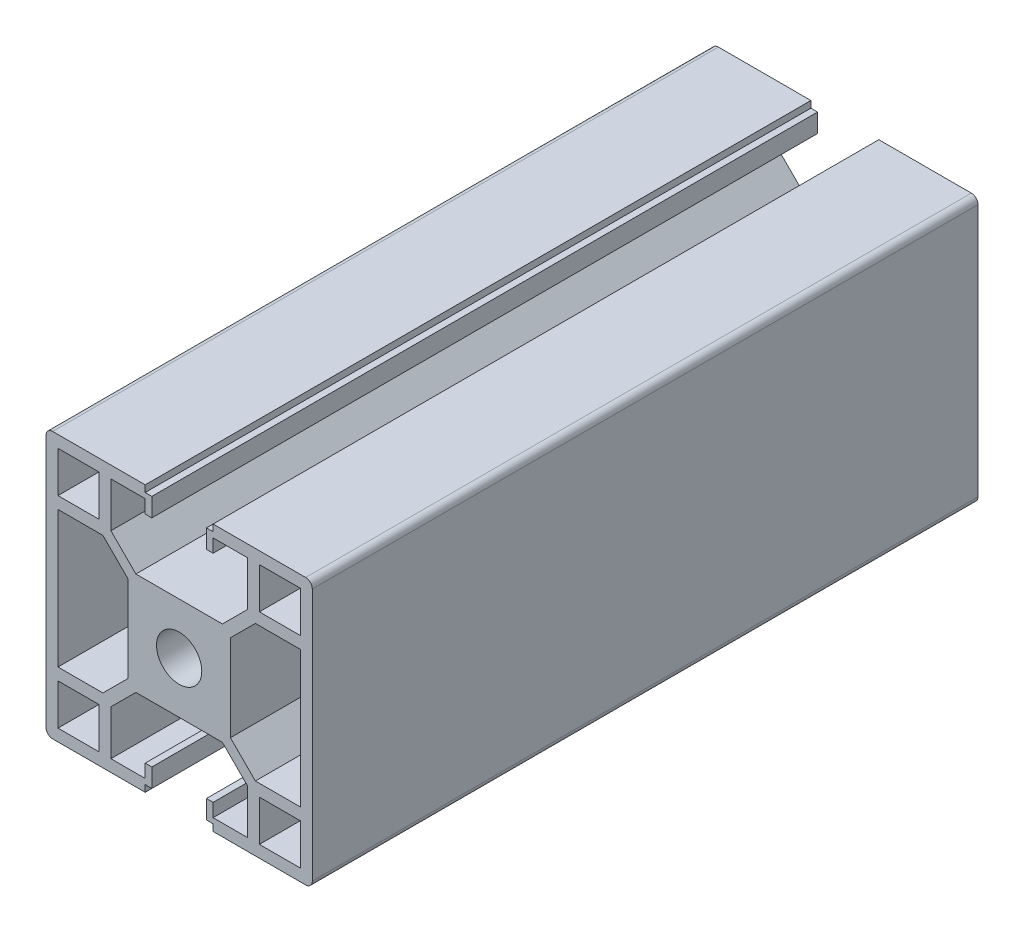
from build123d import *

# Parameters (mm, degrees)
SKETCH_1_R      = 3.4
SKETCH_1_W      = 6.15
SKETCH_1_H      = 6.15
EXTRUDE_1_DEPTH = 100


with BuildPart() as part:
    # 草图1 → 凸台-拉伸1 (new body)
    with BuildSketch(Plane.XY):
        with BuildLine():
            Line((-4.068782805, 19.545792426), (-17.968782805, 19.545792426))
            ThreePointArc((-17.968782805, 19.545792426), (-18.675889586, 19.252899208), (-18.968782805, 18.545792426))
            Line((-18.968782805, 18.545792426), (-18.968782805, -19.454207574))
            ThreePointArc((-18.968782805, -19.454207574), (-18.675889586, -20.161314355), (-17.968782805, -20.454207574))
            Line((-17.968782805, -20.454207574), (-4.068782805, -20.454207574))
            Line((-4.068782805, -20.454207574), (-4.068782805, -19.454207574))
            Line((-4.068782805, -19.454207574), (-3.068782805, -19.454207574))
            Line((-3.068782805, -19.454207574), (-3.068782805, -16.654207574))
            Line((-3.068782805, -16.654207574), (-4.068782805, -16.654207574))
            Line((-4.068782805, -16.654207574), (-4.068782805, -18.654207574))
            Line((-4.068782805, -18.654207574), (-9.218782805, -18.654207574))
            Line((-9.218782805, -18.654207574), (-9.218782805, -11.906289102))
            Line((-9.218782805, -11.906289102), (-5.466701277, -8.154207574))
            Line((-5.466701277, -8.154207574), (7.529135667, -8.154207574))
            Line((7.529135667, -8.154207574), (11.281217195, -11.906289102))
            Line((11.281217195, -11.906289102), (11.281217195, -18.654207574))
            Line((11.281217195, -18.654207574), (6.131217195, -18.654207574))
            Line((6.131217195, -18.654207574), (6.131217195, -16.654207574))
            Line((6.131217195, -16.654207574), (5.131217195, -16.654207574))
            Line((5.131217195, -16.654207574), (5.131217195, -19.454207574))
            Line((5.131217195, -19.454207574), (6.131217195, -19.454207574))
            Line((6.131217195, -19.454207574), (6.131217195, -20.454207574))
            Line((6.131217195, -20.454207574), (20.031217195, -20.454207574))
            ThreePointArc((20.031217195, -20.454207574), (20.738323976, -20.161314355), (21.031217195, -19.454207574))
            Line((21.031217195, -19.454207574), (21.031217195, 18.545792426))
            ThreePointArc((21.031217195, 18.545792426), (20.738323976, 19.252899208), (20.031217195, 19.545792426))
            Line((20.031217195, 19.545792426), (6.131217195, 19.545792426))
            Line((6.131217195, 19.545792426), (6.131217195, 18.545792426))
            Line((6.131217195, 18.545792426), (5.131217195, 18.545792426))
            Line((5.131217195, 18.545792426), (5.131217195, 15.745792426))
            Line((5.131217195, 15.745792426), (6.131217195, 15.745792426))
            Line((6.131217195, 15.745792426), (6.131217195, 17.745792426))
            Line((6.131217195, 17.745792426), (11.281217195, 17.745792426))
            Line((11.281217195, 17.745792426), (11.281217195, 10.997873954))
            Line((11.281217195, 10.997873954), (7.529135667, 7.245792426))
            Line((7.529135667, 7.245792426), (-5.466701277, 7.245792426))
            Line((-5.466701277, 7.245792426), (-9.218782805, 10.997873954))
            Line((-9.218782805, 10.997873954), (-9.218782805, 17.745792426))
            Line((-9.218782805, 17.745792426), (-4.068782805, 17.745792426))
            Line((-4.068782805, 17.745792426), (-4.068782805, 15.745792426))
            Line((-4.068782805, 15.745792426), (-3.068782805, 15.745792426))
            Line((-3.068782805, 15.745792426), (-3.068782805, 18.545792426))
            Line((-3.068782805, 18.545792426), (-4.068782805, 18.545792426))
            Line((-4.068782805, 18.545792426), (-4.068782805, 19.545792426))
        make_face()
        with Locations((1.031217195, -0.454207574)):
            Circle(SKETCH_1_R, mode=Mode.SUBTRACT)
        with Locations((-14.093782805, 14.670792426)):
            Rectangle(SKETCH_1_W, SKETCH_1_H, mode=Mode.SUBTRACT)
        Polygon((-6.668782805, 6.043710898), (-6.668782805, -6.952126046), (-10.420864333, -10.704207574), (-17.168782805, -10.704207574), (-17.168782805, 9.795792426), (-10.420864333, 9.795792426), align=None, mode=Mode.SUBTRACT)
        Polygon((8.731217195, -6.952126046), (8.731217195, 6.043710898), (12.483298723, 9.795792426), (19.231217195, 9.795792426), (19.231217195, -10.704207574), (12.483298723, -10.704207574), align=None, mode=Mode.SUBTRACT)
        with Locations((16.156217195, 14.670792426)):
            Rectangle(SKETCH_1_W, SKETCH_1_H, mode=Mode.SUBTRACT)
        with Locations((-14.093782805, -15.579207574)):
            Rectangle(SKETCH_1_W, SKETCH_1_H, mode=Mode.SUBTRACT)
        with Locations((16.156217195, -15.579207574)):
            Rectangle(SKETCH_1_W, SKETCH_1_H, mode=Mode.SUBTRACT)
    extrude(amount=EXTRUDE_1_DEPTH)


solid = part.part
